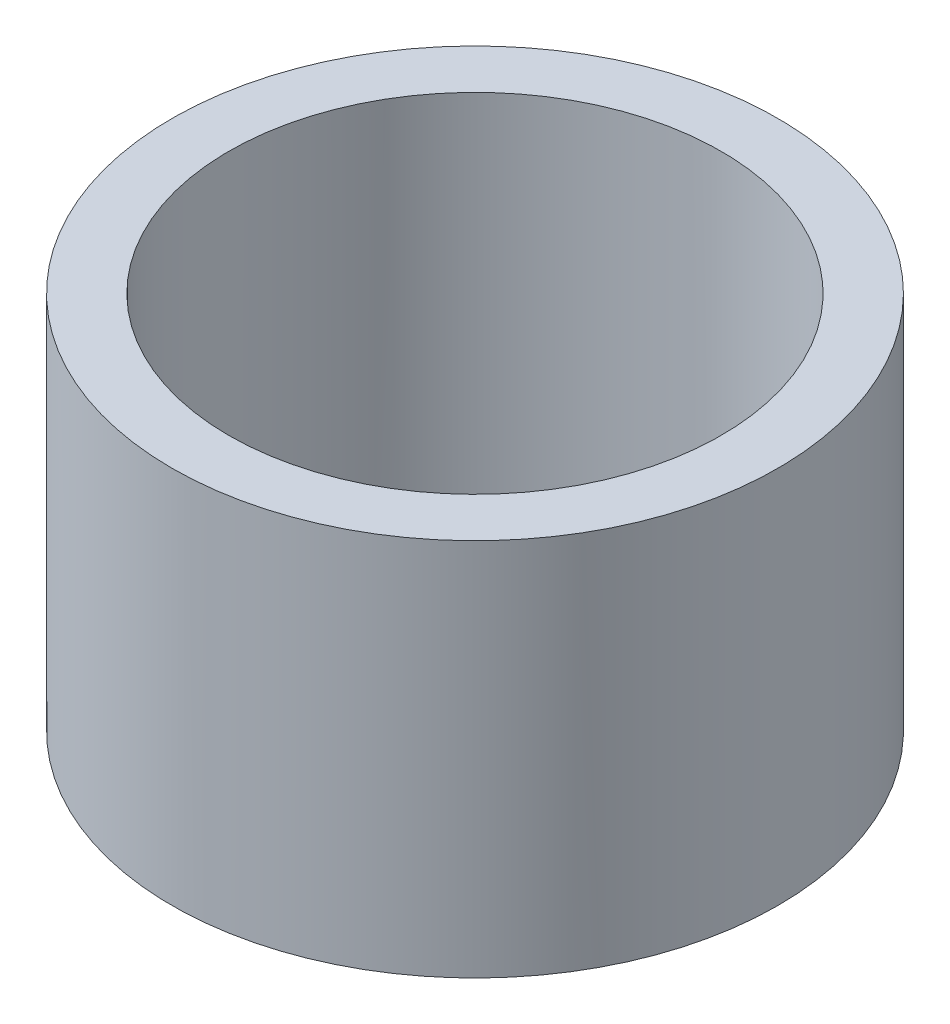
from build123d import *

# Parameters (mm, degrees)
SKETCH1_R           = 20.32
BOSS_EXTRUDE1_DEPTH = 25.4
SKETCH2_R           = 16.51
CUT_EXTRUDE1_DEPTH  = 39.353158931
SKETCH3_R           = 6.35
CUT_EXTRUDE2_DEPTH  = 39.353158931


with BuildPart() as part:
    # Sketch1 → Boss-Extrude1 (new body)
    with BuildSketch(Plane(origin=(0, 0, 0), x_dir=(1, 0, 0), z_dir=(0, 1, 0))):
        with Locations(Location((0, 0, 0), (0, 0, 270))):
            Circle(SKETCH1_R)
    extrude(amount=BOSS_EXTRUDE1_DEPTH)

    # Sketch2 → Cut-Extrude1 (cut, through all)
    with BuildSketch(Plane(origin=(0, 25.4, 0), x_dir=(1, 0, 0), z_dir=(0, 1, 0))):
        with Locations(Location((0, 0, 0), (0, 0, 270))):
            Circle(SKETCH2_R)
    extrude(amount=-CUT_EXTRUDE1_DEPTH, mode=Mode.SUBTRACT)

    # Sketch3 → Cut-Extrude2 (cut, through all)
    with BuildSketch(Plane.XY):
        Circle(SKETCH3_R)
    extrude(amount=-CUT_EXTRUDE2_DEPTH, mode=Mode.SUBTRACT)


solid = part.part
